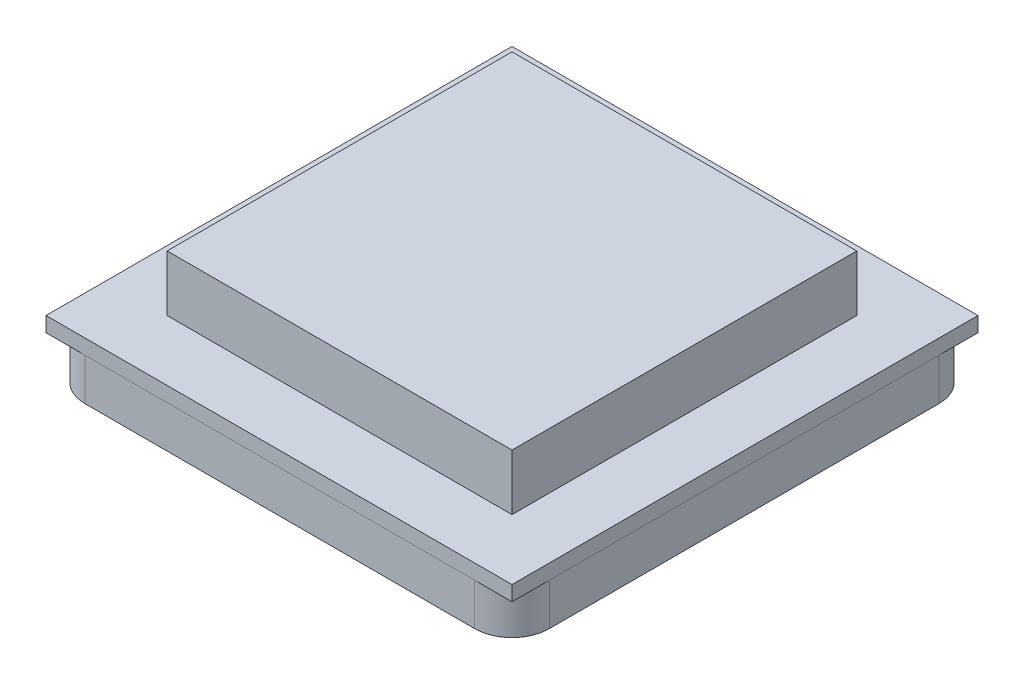
from build123d import *

# Parameters (mm, degrees)
SKETCH1_W           = 25
SKETCH1_H           = 25
BOSS_EXTRUDE1_DEPTH = 0.8
SKETCH2_W           = 18.5
SKETCH2_H           = 18.5
BOSS_EXTRUDE2_DEPTH = 3
BOSS_EXTRUDE4_DEPTH = 2.3


with BuildPart() as part:
    # Sketch1 → Boss-Extrude1 (new body)
    with BuildSketch(Plane(origin=(0, 0, 0), x_dir=(1, 0, 0), z_dir=(0, 1, 0))):
        Rectangle(SKETCH1_W, SKETCH1_H)
    extrude(amount=BOSS_EXTRUDE1_DEPTH)

    # Sketch2 → Boss-Extrude2 (add)
    with BuildSketch(Plane(origin=(0, 0.8, 0), x_dir=(1, 0, 0), z_dir=(0, 1, 0))):
        Rectangle(SKETCH2_W, SKETCH2_H)
    extrude(amount=BOSS_EXTRUDE2_DEPTH)

    # Sketch3 → Boss-Extrude4 (add)
    with BuildSketch(Plane.XZ):
        with BuildLine():
            Line((-10.45, -12.45), (10.45, -12.45))
            ThreePointArc((10.45, -12.45), (11.864213562, -11.864213562), (12.45, -10.45))
            Line((12.45, -10.45), (12.45, 10.45))
            ThreePointArc((12.45, 10.45), (11.864213562, 11.864213562), (10.45, 12.45))
            Line((10.45, 12.45), (-10.45, 12.45))
            ThreePointArc((-10.45, 12.45), (-11.864213562, 11.864213562), (-12.45, 10.45))
            Line((-12.45, 10.45), (-12.45, -10.45))
            ThreePointArc((-12.45, -10.45), (-11.864213562, -11.864213562), (-10.45, -12.45))
        make_face()
    extrude(amount=BOSS_EXTRUDE4_DEPTH)


solid = part.part
